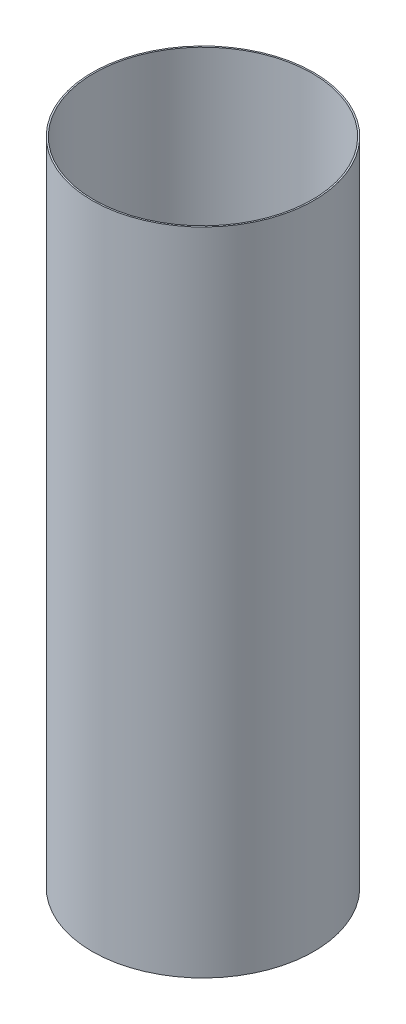
from build123d import *

# Parameters (mm, degrees)
SKETCH1_R           = 37.5
SKETCH1_R_2         = 37
BOSS_EXTRUDE1_DEPTH = 220
SKETCH2_R           = 37.5
BOSS_EXTRUDE2_DEPTH = 1


with BuildPart() as part:
    # Sketch1 → Boss-Extrude1 (new body)
    with BuildSketch(Plane(origin=(0, 0, 0), x_dir=(1, 0, 0), z_dir=(0, 1, 0))):
        with Locations(Location((0, 0, 0), (0, 0, 270))):
            Circle(SKETCH1_R)
        with Locations(Location((0, 0, 0), (0, 0, 270))):
            Circle(SKETCH1_R_2, mode=Mode.SUBTRACT)
    extrude(amount=BOSS_EXTRUDE1_DEPTH)

    # Sketch2 → Boss-Extrude2 (add)
    with BuildSketch(Plane(origin=(0, 0, 0), x_dir=(1, 0, 0), z_dir=(0, 1, 0))):
        with Locations(Location((0, 0, 0), (0, 0, 270))):
            Circle(SKETCH2_R)
    extrude(amount=BOSS_EXTRUDE2_DEPTH)


solid = part.part
